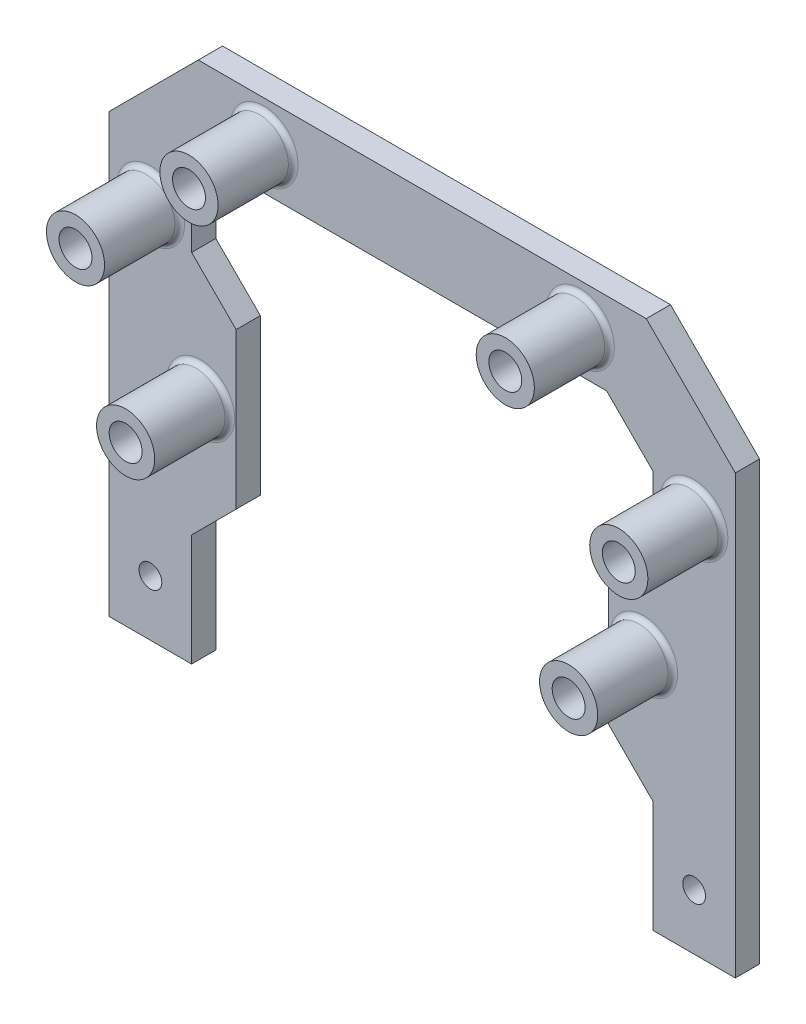
from build123d import *

# Parameters (mm, degrees)
BOSS_EXTRUDE2_DEPTH = 5
SKETCH4_R           = 6
BOSS_EXTRUDE3_DEPTH = 15.5
FILLET1_R           = 1
CUT_EXTRUDE1_REACH  = 130.031
SKETCH5_R           = 2.35
SKETCH6_R           = 3.4
CUT_EXTRUDE2_DEPTH  = 10


with BuildPart() as part:
    # Sketch2 → Boss-Extrude2 (new body)
    with BuildSketch(Plane.XY):
        Polygon((-38.034853609, 91.624315191), (0, 91.624315191), (38.034853609, 91.624315191), (47.595357442, 82.063811359), (47.595357442, 73.548798616), (38.402969286, 64.356410461), (38.402969286, 32.26790473), (47.595357442, 23.075516575), (47.595357442, 0), (64.595357442, 0), (64.595357442, 90.244528717), (46.215570967, 108.624315191), (0, 108.624315191), (-46.215570967, 108.624315191), (-64.595357442, 90.244528717), (-64.595357442, 0), (-47.595357442, 0), (-47.595357442, 23.075516575), (-38.402969286, 32.26790473), (-38.402969286, 64.356410461), (-47.595357442, 73.548798616), (-47.595357442, 82.063811359), align=None)
    extrude(amount=-BOSS_EXTRUDE2_DEPTH)

    # Sketch4 → Boss-Extrude3 (add)
    with BuildSketch(Plane.XY):
        with Locations(Location((45.702969286, 48.312157595, 0), (0, 0, 180))):
            Circle(SKETCH4_R)
        with Locations(Location((56.046263063, 77.806304987, 0), (0, 0, 180))):
            Circle(SKETCH4_R)
        with Locations(Location((32.627642792, 100.189552245, 0), (0, 0, 180))):
            Circle(SKETCH4_R)
        with Locations(Location((-32.627642792, 100.189552245, 0), (0, 0, 180))):
            Circle(SKETCH4_R)
        with Locations(Location((-45.702969286, 48.312157595, 0), (0, 0, 180))):
            Circle(SKETCH4_R)
        with Locations(Location((-56.046263063, 77.806304987, 0), (0, 0, 180))):
            Circle(SKETCH4_R)
    extrude(amount=BOSS_EXTRUDE3_DEPTH)

    # Fillet1
    fillet1_edges = [part.edges().sort_by_distance(p)[0] for p in [
        (51.702969286, 48.312157595, 0),
        (-50.046263063, 77.806304987, 0),
        (-39.702969286, 48.312157595, 0),
        (-26.627642792, 100.189552245, 0),
        (38.627642792, 100.189552245, 0),
        (62.046263063, 77.806304987, 0),
    ]]
    fillet(fillet1_edges, radius=FILLET1_R)

    # Sketch5 → Cut-Extrude1 (cut, up to next)
    with BuildSketch(Plane(origin=(0, 0, -5), x_dir=(-1, 0, 0), z_dir=(0, 0, -1)), mode=Mode.PRIVATE) as cut_extrude1_sk1:
        with Locations((56.095357442, 11.5)):
            Circle(SKETCH5_R)
    cut_extrude1_tool1 = extrude(cut_extrude1_sk1.sketch, amount=-CUT_EXTRUDE1_REACH, mode=Mode.PRIVATE) & part.part
    # Sketch5 → Cut-Extrude1 (cut, up to next)
    with BuildSketch(Plane(origin=(0, 0, -5), x_dir=(-1, 0, 0), z_dir=(0, 0, -1)), mode=Mode.PRIVATE) as cut_extrude1_sk2:
        with Locations((-56.095357442, 11.5)):
            Circle(SKETCH5_R)
    cut_extrude1_tool2 = extrude(cut_extrude1_sk2.sketch, amount=-CUT_EXTRUDE1_REACH, mode=Mode.PRIVATE) & part.part
    add(cut_extrude1_tool1.solids().sort_by_distance((-56.095357, 11.5, -5))[0], mode=Mode.SUBTRACT)
    add(cut_extrude1_tool2.solids().sort_by_distance((56.095357, 11.5, -5))[0], mode=Mode.SUBTRACT)

    # Sketch6 → Cut-Extrude2 (cut)
    with BuildSketch(Plane.XY.offset(15.5)):
        with Locations((-56.046263063, 77.806304987)):
            Circle(SKETCH6_R)
        with Locations((-32.627642792, 100.189552245)):
            Circle(SKETCH6_R)
        with Locations((32.627642792, 100.189552245)):
            Circle(SKETCH6_R)
        with Locations((56.046263063, 77.806304987)):
            Circle(SKETCH6_R)
        with Locations((45.702969286, 48.312157595)):
            Circle(SKETCH6_R)
        with Locations((-45.702969286, 48.312157595)):
            Circle(SKETCH6_R)
    extrude(amount=-CUT_EXTRUDE2_DEPTH, mode=Mode.SUBTRACT)


solid = part.part
